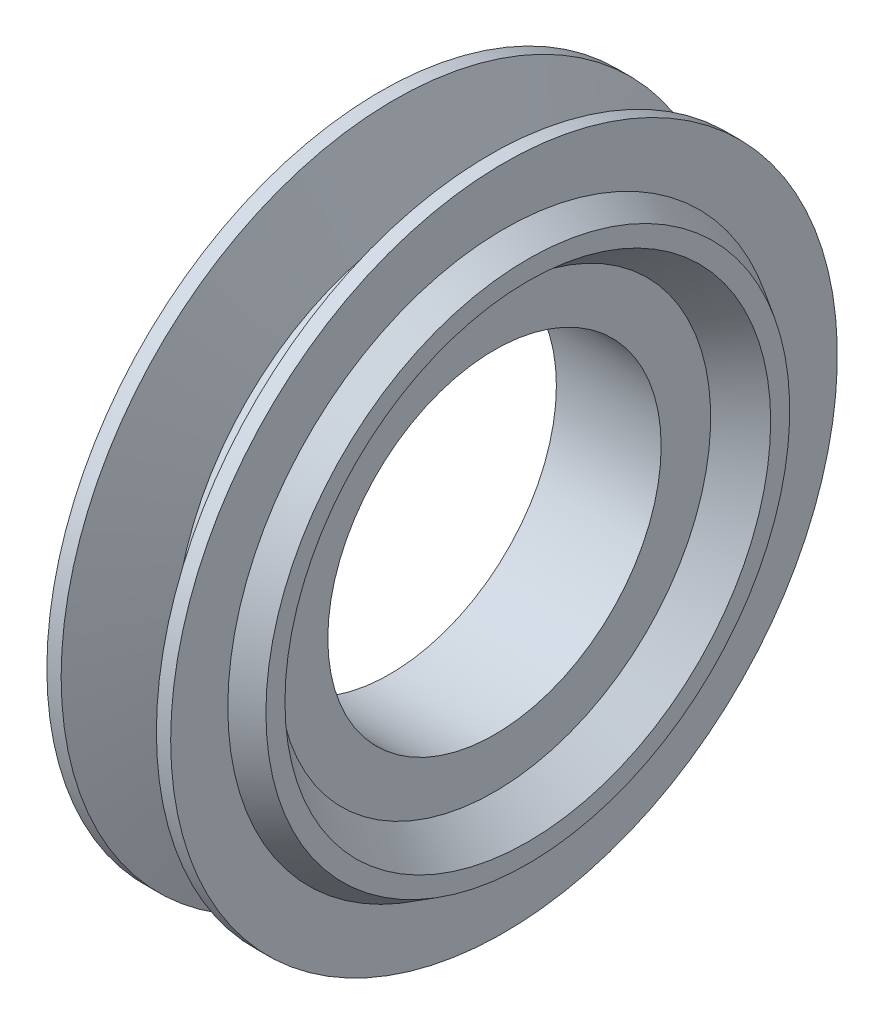
from build123d import *

# Parameters (mm, degrees)
SKETCH_2_R          = 17.5
CUT_EXTRUDE_1_DEPTH = 52.577611422
SKETCH_4_W          = 5.67471706
SKETCH_4_H          = 4.873840026


with BuildPart() as part:
    # Эскиз1 → Повернуть1 (revolve)
    with BuildSketch(Plane.XY, mode=Mode.PRIVATE) as revolve_1_sk:
        Polygon((5.5, 0), (5.5, 22.7), (9, 25.5), (9, 27.5), (6.5, 29), (6.5, 35), (5, 35), (1, 22.7), (-1, 22.7), (-5, 35), (-6.5, 35), (-6.5, 29), (-9, 27.5), (-9, 25.5), (-5.5, 22.7), (-5.5, 0), align=None)
    revolve(revolve_1_sk.sketch.rotate(Axis((-55.549199464, 0, 0), (1, 0, 0)), 90), axis=Axis((-55.549199464, 0, 0), (1, 0, 0)))

    # Эскиз2 → Вырез-Вытянуть1 (cut, through all)
    with BuildSketch(Plane(origin=(5.5, 0, 0), x_dir=(0, 0, -1), z_dir=(1, 0, 0))):
        Circle(SKETCH_2_R)
    extrude(amount=-CUT_EXTRUDE_1_DEPTH, mode=Mode.SUBTRACT)

    # Эскиз4 → Повернуть2 (revolve)
    with BuildSketch(Plane.XY, mode=Mode.PRIVATE) as revolve_2_sk:
        with Locations((0, 23.563079987)):
            Rectangle(SKETCH_4_W, SKETCH_4_H)
    revolve(revolve_2_sk.sketch.rotate(Axis((-55.549199464, 0, 0), (1, 0, 0)), 90), axis=Axis((-55.549199464, 0, 0), (1, 0, 0)))


solid = part.part
